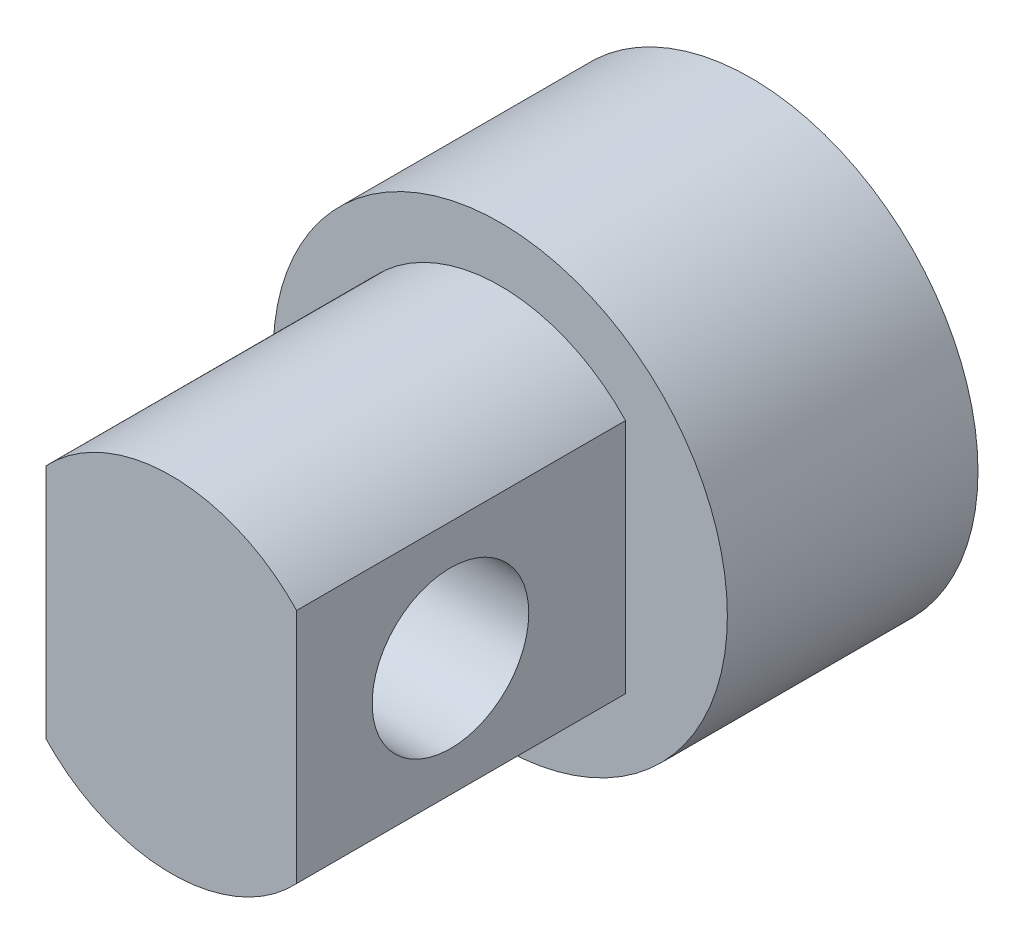
from build123d import *

# Parameters (mm, degrees)
BOSS_EXTRUDE1_DEPTH     = 21
SKETCH3_R               = 14.5
BOSS_EXTRUDE2_DEPTH     = 16
CUT_EXTRUDE1_DEPTH      = 30.351320243
CUT_EXTRUDE1_DEPTH_BACK = 30.351320243
SKETCH4_R               = 5


with BuildPart() as part:
    # Sketch1 → Boss-Extrude1 (new body)
    with BuildSketch(Plane.XY):
        with BuildLine():
            Line((-8, 7.549834435), (-8, -7.549834435))
            ThreePointArc((-8, -7.549834435), (0, -11), (8, -7.549834435))
            Line((8, -7.549834435), (8, 7.549834435))
            ThreePointArc((8, 7.549834435), (0, 11), (-8, 7.549834435))
        make_face()
    extrude(amount=BOSS_EXTRUDE1_DEPTH)

    # Sketch3 → Boss-Extrude2 (add)
    with BuildSketch(Plane.XY):
        Circle(SKETCH3_R)
    extrude(amount=-BOSS_EXTRUDE2_DEPTH)

    # Sketch4 → Cut-Extrude1 (cut, two sides: drawn at the far end of the back side and taken through both)
    with BuildSketch(Plane(origin=(0, 0, 0), x_dir=(0, 0, -1), z_dir=(1, 0, 0)).offset(-CUT_EXTRUDE1_DEPTH_BACK)):
        with Locations((-11.179145377, 0)):
            Circle(SKETCH4_R)
    extrude(amount=CUT_EXTRUDE1_DEPTH + CUT_EXTRUDE1_DEPTH_BACK, mode=Mode.SUBTRACT)


solid = part.part
